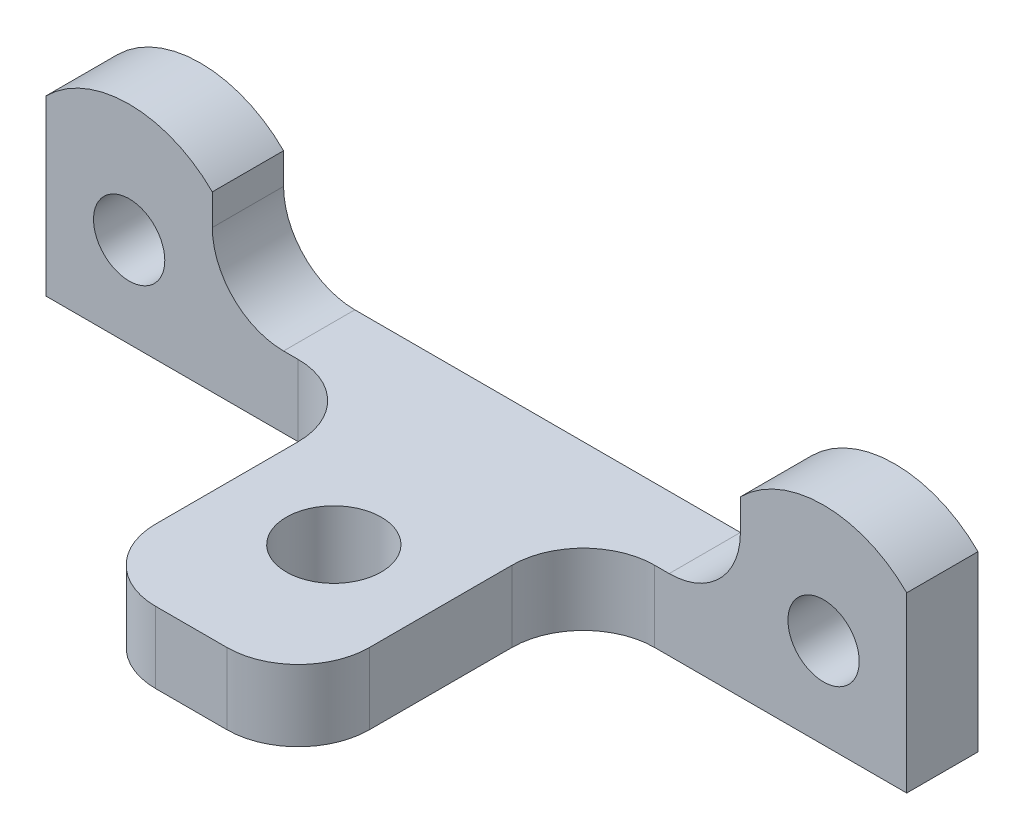
from build123d import *

# Parameters (mm, degrees)
ESQUISSE1_R             = 1.5
BOSS_EXTRU_1_DEPTH      = 3
ESQUISSE2_W             = 9
ESQUISSE2_H             = 3
BOSS_EXTRU_2_DEPTH      = 12
ESQUISSE3_R             = 2
ENL_V_MAT_EXTRU_1_DEPTH = 25.211832251
CONG_1_R                = 3


with BuildPart() as part:
    # Esquisse1 → Boss.-Extru.1 (new body)
    with BuildSketch(Plane.XY):
        with BuildLine():
            Line((-18.115, 7.3), (-18.115, 0))
            Line((-18.115, 0), (18.115, 0))
            Line((18.115, 0), (18.115, 7.3))
            ThreePointArc((18.115, 7.3), (14.615, 8.749747468), (11.115, 7.3))
            Line((11.115, 7.3), (11.115, 3))
            Line((11.115, 3), (-11.115, 3))
            Line((-11.115, 3), (-11.115, 7.3))
            ThreePointArc((-11.115, 7.3), (-14.615, 8.749747468), (-18.115, 7.3))
        make_face()
        with Locations((-14.615, 3.8)):
            Circle(ESQUISSE1_R, mode=Mode.SUBTRACT)
        with Locations((14.615, 3.8)):
            Circle(ESQUISSE1_R, mode=Mode.SUBTRACT)
    extrude(amount=BOSS_EXTRU_1_DEPTH)

    # Esquisse2 → Boss.-Extru.2 (add)
    with BuildSketch(Plane.XY.offset(3)):
        with Locations((0, 1.5)):
            Rectangle(ESQUISSE2_W, ESQUISSE2_H)
    extrude(amount=BOSS_EXTRU_2_DEPTH)

    # Esquisse3 → Enlèv. mat.-Extru.1 (cut, through all)
    with BuildSketch(Plane(origin=(0, 3, 0), x_dir=(1, 0, 0), z_dir=(0, 1, 0))):
        with Locations(Location((0, -9, 0), (0, 0, 270))):
            Circle(ESQUISSE3_R)
    extrude(amount=-ENL_V_MAT_EXTRU_1_DEPTH, mode=Mode.SUBTRACT)

    # Congé1
    cong_1_edges = [part.edges().sort_by_distance(p)[0] for p in [
        (-11.115, 3, 1.5),
        (11.115, 3, 1.5),
        (-4.5, 1.5, 3),
        (4.5, 1.5, 3),
        (-4.5, 1.5, 15),
        (4.5, 1.5, 15),
    ]]
    fillet(cong_1_edges, radius=CONG_1_R)


solid = part.part
